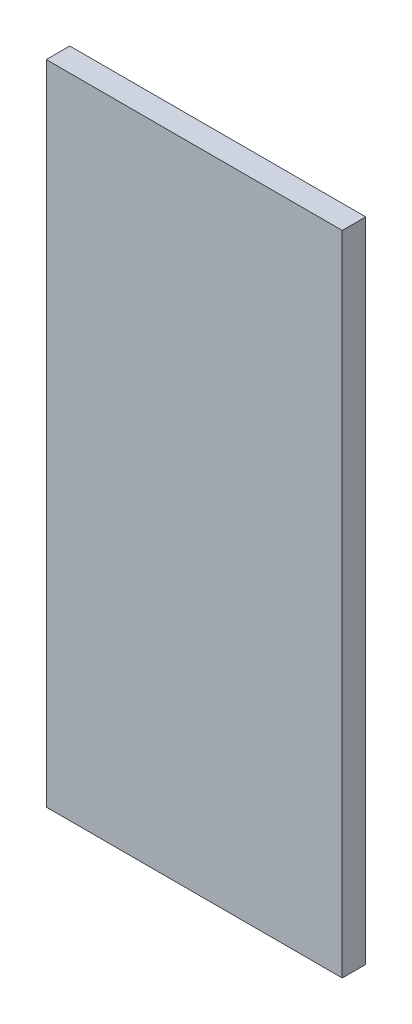
from build123d import *

# Parameters (mm, degrees)
CROQUIS1_W              = 160
CROQUIS1_H              = 350
SALIENTE_EXTRUIR1_DEPTH = 12.7


with BuildPart() as part:
    # Croquis1 → Saliente-Extruir1 (new body)
    with BuildSketch(Plane.XY):
        Rectangle(CROQUIS1_W, CROQUIS1_H)
    extrude(amount=SALIENTE_EXTRUIR1_DEPTH)


solid = part.part
